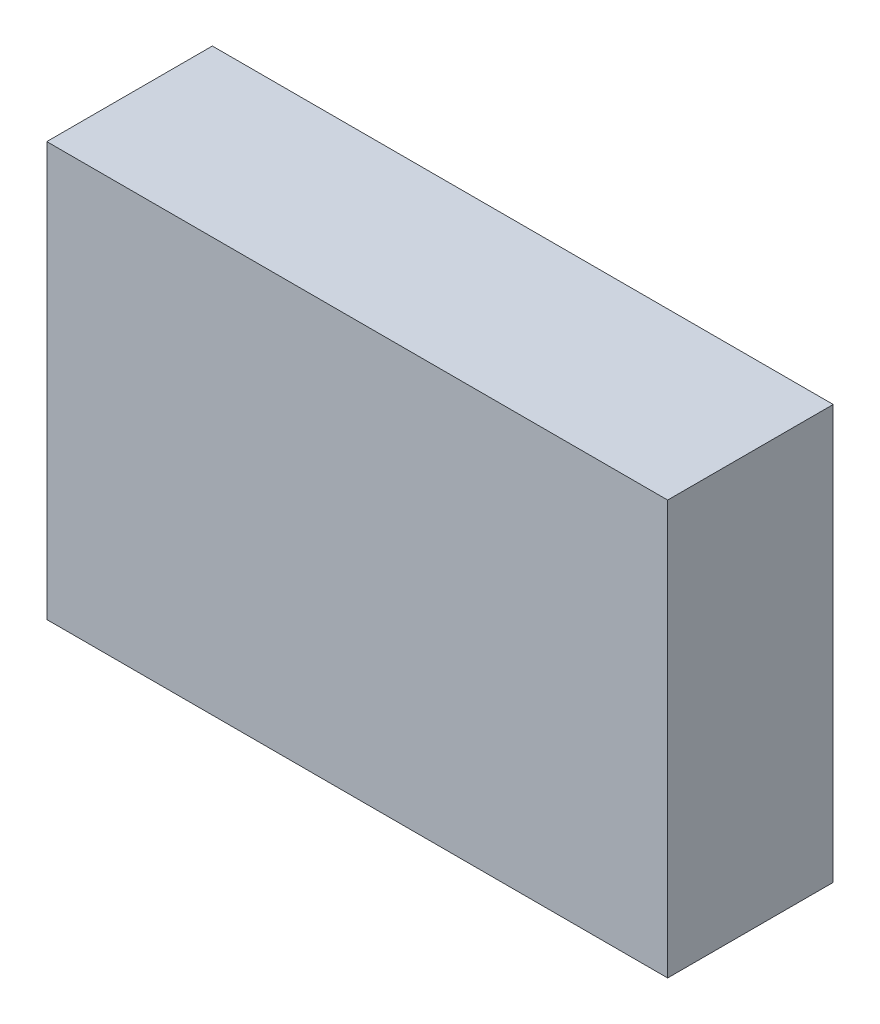
from build123d import *

# Parameters (mm, degrees)
SKETCH1_W           = 37.5
SKETCH1_H           = 25
BOSS_EXTRUDE1_DEPTH = 10


with BuildPart() as part:
    # Sketch1 → Boss-Extrude1 (new body)
    with BuildSketch(Plane.XY):
        Rectangle(SKETCH1_W, SKETCH1_H)
    extrude(amount=BOSS_EXTRUDE1_DEPTH)


solid = part.part
